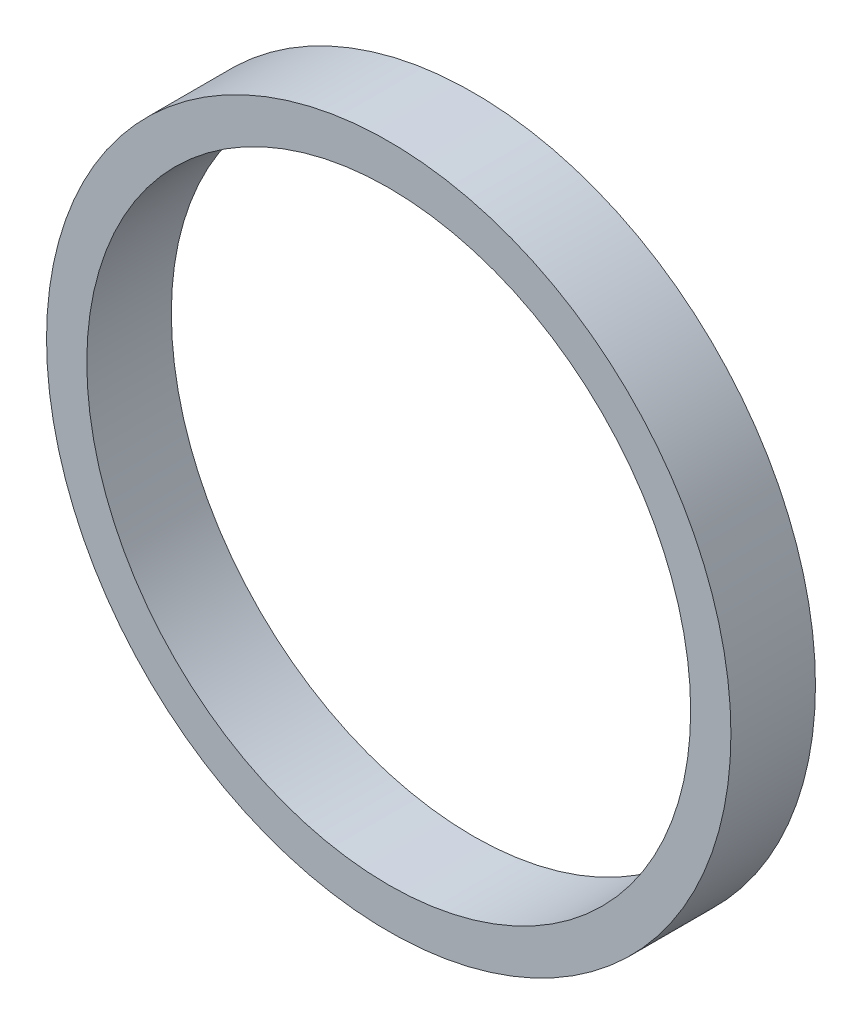
from build123d import *

# Parameters (mm, degrees)
SKETCH1_R           = 8.5
SKETCH1_R_2         = 7.5
BOSS_EXTRUDE1_DEPTH = 2.1


with BuildPart() as part:
    # Sketch1 → Boss-Extrude1 (new body)
    with BuildSketch(Plane.XY):
        Circle(SKETCH1_R)
        Circle(SKETCH1_R_2, mode=Mode.SUBTRACT)
    extrude(amount=BOSS_EXTRUDE1_DEPTH)


solid = part.part
